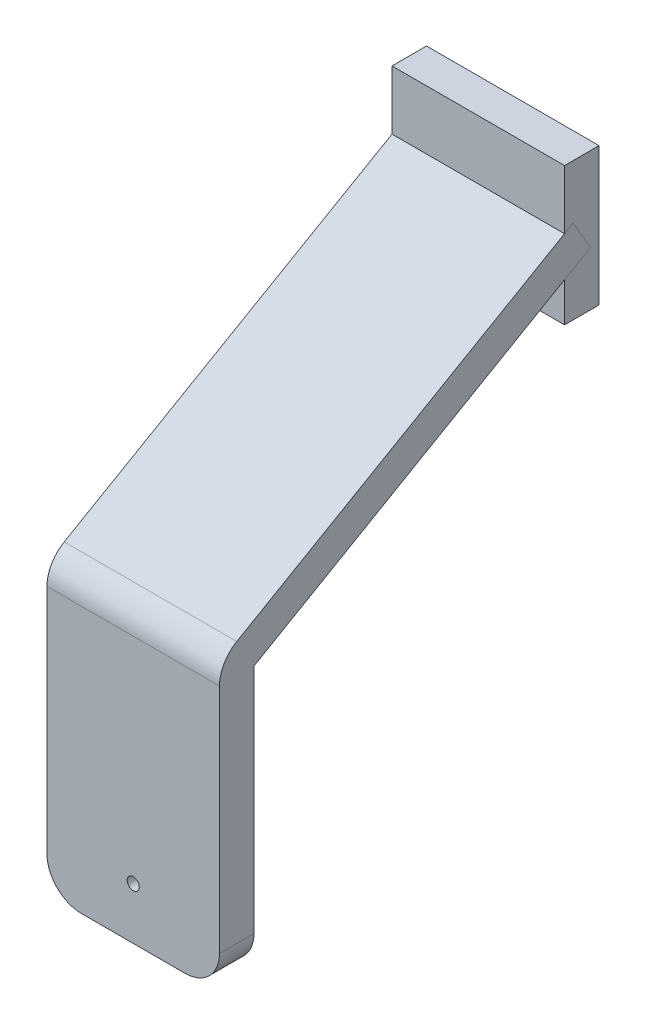
from build123d import *

# Parameters (mm, degrees)
EXTRUDE_THIN1_DEPTH     = 50
SKETCH2_W               = 40
SKETCH2_H               = 10
EXTRUDE_THIN1_2_DEPTH   = 50
FILLET2_R               = 10
FILLET3_R               = 10
CUT_EXTRUDE1_DEPTH      = 196.972800963
CUT_EXTRUDE1_DEPTH_BACK = 5
SKETCH3_R               = 1.75


with BuildPart() as part:
    # Sketch2 → Extrude-Thin1 (new body)
    with BuildSketch(Plane.YZ):
        Polygon((0, -5), (77.113248654, -5), (133.4048999, -102.5), (142.065153938, -97.5), (82.886751346, 5), (0, 5), align=None)
    extrude(amount=EXTRUDE_THIN1_DEPTH)

    # Fillet2
    fillet2_edges = [part.edges().sort_by_distance(p)[0] for p in [
        (50, 0, 0),
        (0, 0, 0),
    ]]
    fillet(fillet2_edges, radius=FILLET2_R)

    # Fillet3
    fillet3_edges = [part.edges().sort_by_distance(p)[0] for p in [
        (25, 82.886751346, 5),
    ]]
    fillet(fillet3_edges, radius=FILLET3_R)

    # Sketch3 → Cut-Extrude1 (cut, two sides: drawn at the far end of the back side and taken through both)
    with BuildSketch(Plane(origin=(0, 0, 0), x_dir=(0, 1, 0), z_dir=(0, 0, 1)).offset(-CUT_EXTRUDE1_DEPTH_BACK)):
        with Locations(Location((15, -25, 0), (0, 0, 270))):
            Circle(SKETCH3_R)
    extrude(amount=CUT_EXTRUDE1_DEPTH + CUT_EXTRUDE1_DEPTH_BACK, mode=Mode.SUBTRACT)


with BuildPart() as body_2:
    # Sketch2 → Extrude-Thin1 2 (new body)
    with BuildSketch(Plane.YZ):
        with Locations((137.735026919, -100)):
            Rectangle(SKETCH2_W, SKETCH2_H)
    extrude(amount=EXTRUDE_THIN1_2_DEPTH)


solid = Compound([part.part, body_2.part])
